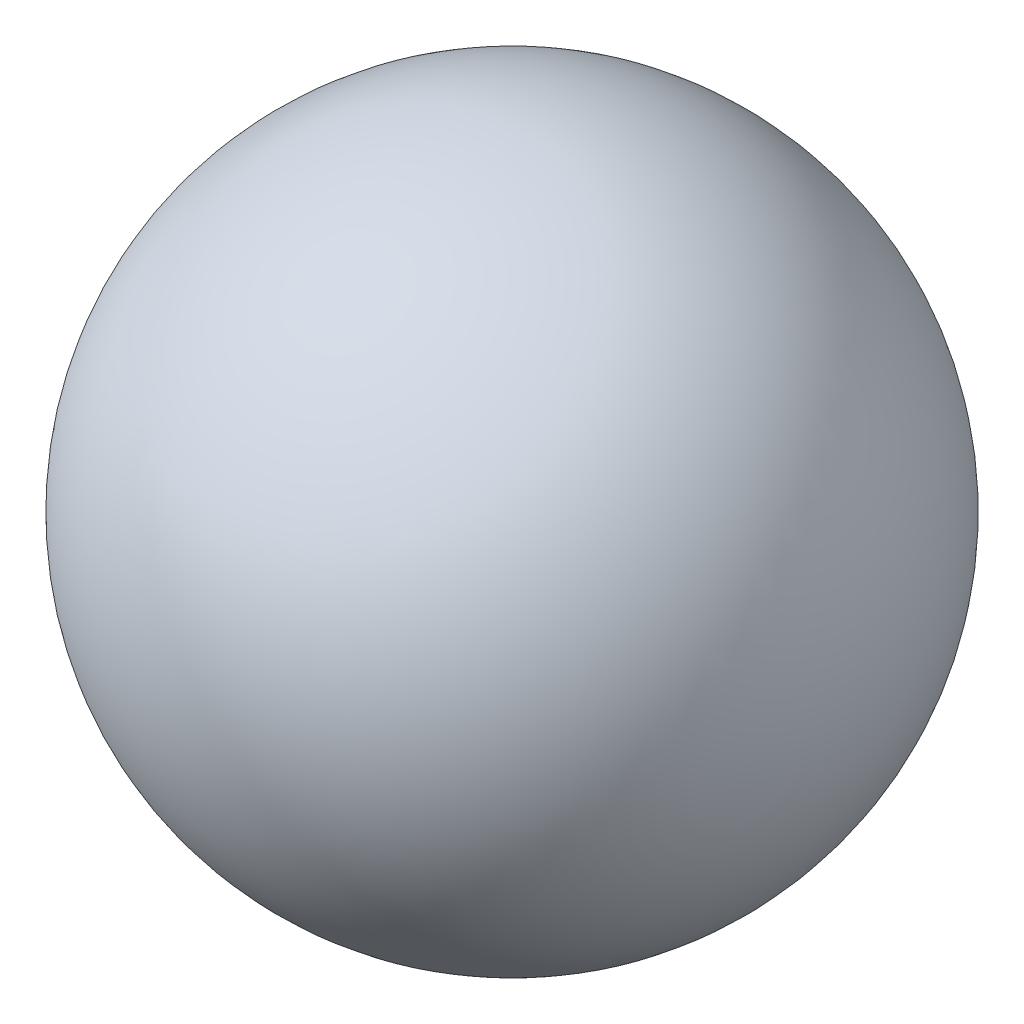
from build123d import *


with BuildPart() as part:
    # Sketch1 → Revolve1 (revolve)
    with BuildSketch(Plane.XY):
        with BuildLine():
            Line((0, 42.480836237), (0, -42.480836237))
            ThreePointArc((0, -42.480836237), (-42.480836237, 0), (0, 42.480836237))
        make_face()
    revolve(axis=Axis((0, 42.480836237, 0), (0, -1, 0)))


solid = part.part
